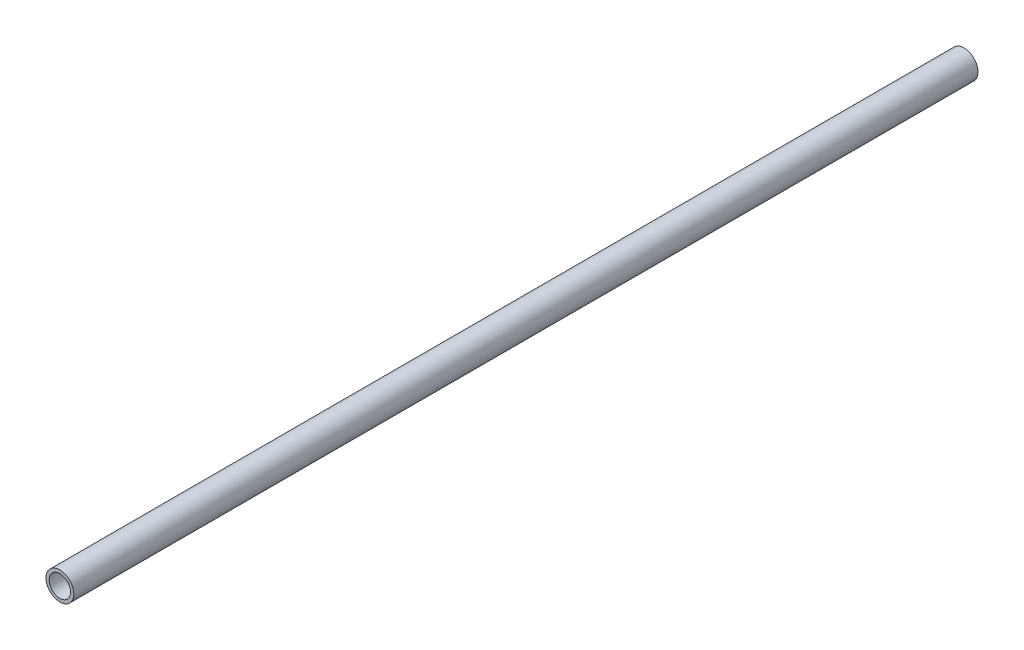
from build123d import *

# Parameters (mm, degrees)
SKETCH3_R           = 6.35
SKETCH3_R_2         = 4.8768
BOSS_EXTRUDE1_DEPTH = 206.375


with BuildPart() as part:
    # Sketch3 → Boss-Extrude1 (new, symmetric)
    with BuildSketch(Plane.XY):
        Circle(SKETCH3_R)
        Circle(SKETCH3_R_2, mode=Mode.SUBTRACT)
    extrude(amount=BOSS_EXTRUDE1_DEPTH, both=True)


solid = part.part
